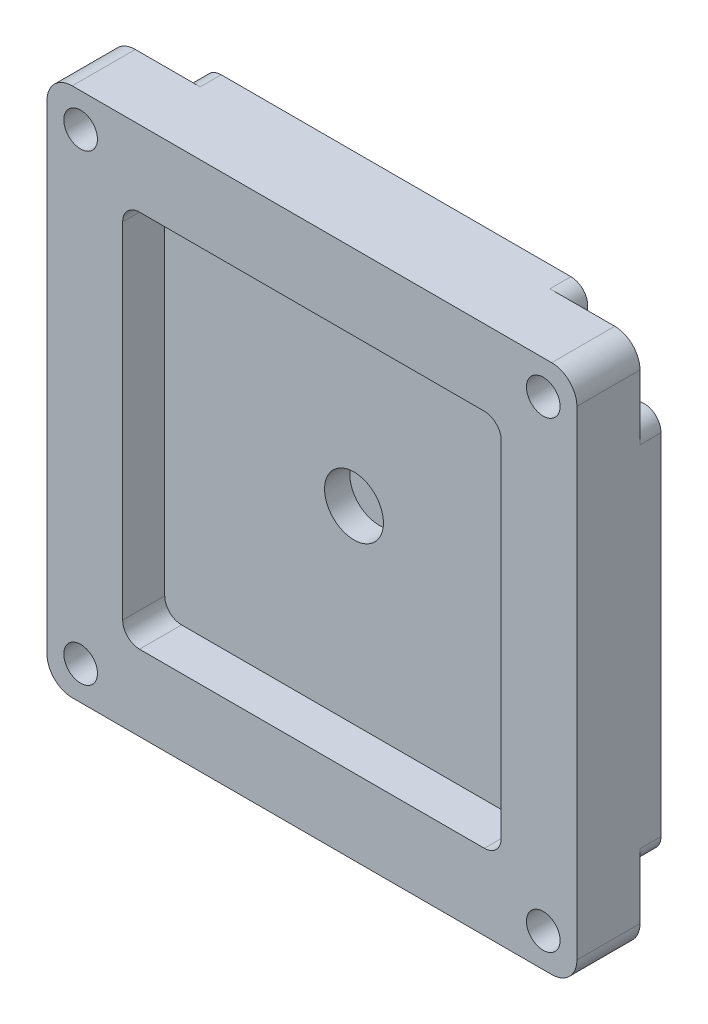
from build123d import *

# Parameters (mm, degrees)
SKETCH1_W                                  = 63
SKETCH1_H                                  = 63
SKETCH1_R                                  = 2
BOSS_EXTRUDE1_DEPTH                        = 5
SKETCH3_W                                  = 45
SKETCH3_H                                  = 45
CUT_EXTRUDE1_DEPTH                         = 5
FILLET1_R                                  = 3
SKETCH4_R                                  = 3.5
CUT_EXTRUDE2_DEPTH                         = 8
FILLET2_R                                  = 2
SKETCH5_R                                  = 5
CUT_EXTRUDE3_DEPTH                         = 2.5
MIRROR1_AT_THE_SECOND_PLANE_COPY_1_SKETC_R = 5
MIRROR1_AT_THE_SECOND_PLANE_COPY_1_DEPTH   = 2.5
FILLET3_R                                  = 2


with BuildPart() as part:
    # Sketch1 → Boss-Extrude1 (new, symmetric)
    with BuildSketch(Plane.XY):
        Rectangle(SKETCH1_W, SKETCH1_H)
        with Locations((-27.5, 27.5)):
            Circle(SKETCH1_R, mode=Mode.SUBTRACT)
        with Locations((27.5, 27.5)):
            Circle(SKETCH1_R, mode=Mode.SUBTRACT)
        with Locations((27.5, -27.5)):
            Circle(SKETCH1_R, mode=Mode.SUBTRACT)
        with Locations((-27.5, -27.5)):
            Circle(SKETCH1_R, mode=Mode.SUBTRACT)
    extrude(amount=BOSS_EXTRUDE1_DEPTH, both=True)

    # Sketch3 → Cut-Extrude1 (cut)
    with BuildSketch(Plane.XY.offset(5)):
        Rectangle(SKETCH3_W, SKETCH3_H)
    extrude(amount=-CUT_EXTRUDE1_DEPTH, mode=Mode.SUBTRACT)

    # Fillet1
    fillet1_edges = [part.edges().sort_by_distance(p)[0] for p in [
        (-31.5, 31.5, 0),
        (31.5, 31.5, 0),
        (31.5, -31.5, 0),
        (-31.5, -31.5, 0),
    ]]
    fillet(fillet1_edges, radius=FILLET1_R)

    # Sketch4 → Cut-Extrude2 (cut)
    with BuildSketch(Plane.XY.offset(5)):
        Circle(SKETCH4_R)
    extrude(amount=-CUT_EXTRUDE2_DEPTH, mode=Mode.SUBTRACT)

    # Fillet2
    fillet2_edges = [part.edges().sort_by_distance(p)[0] for p in [
        (-22.5, -22.5, 2.5),
        (-22.5, 22.5, 2.5),
        (22.5, 22.5, 2.5),
        (22.5, -22.5, 2.5),
    ]]
    fillet(fillet2_edges, radius=FILLET2_R)

    # Sketch5 → Cut-Extrude3 (cut)
    with BuildSketch(Plane(origin=(0, 0, -5), x_dir=(-1, 0, 0), z_dir=(0, 0, -1))):
        with Locations((-27.5, 27.5)):
            Circle(SKETCH5_R)
    cut_extrude3 = extrude(amount=-CUT_EXTRUDE3_DEPTH, mode=Mode.SUBTRACT)

    # Mirror1: Cut-Extrude3 across plane
    add(cut_extrude3.mirror(Plane(origin=(0, 0, 0), x_dir=(0, 0, 1), z_dir=(1, 0, 0))), mode=Mode.SUBTRACT)

    # Mirror1 at the second plane: Cut-Extrude3 across plane
    add(cut_extrude3.mirror(Plane.ZX), mode=Mode.SUBTRACT)

    # Mirror1 at the second plane copy 1 sketc → Mirror1 at the second plane copy 1 (cut)
    with BuildSketch(Plane(origin=(0, 0, -5), x_dir=(1, 0, 0), z_dir=(0, 0, -1))):
        with Locations((-27.5, 27.5)):
            Circle(MIRROR1_AT_THE_SECOND_PLANE_COPY_1_SKETC_R)
    extrude(amount=-MIRROR1_AT_THE_SECOND_PLANE_COPY_1_DEPTH, mode=Mode.SUBTRACT)

    # Fillet3
    fillet3_edges = [part.edges().sort_by_distance(p)[0] for p in [
        (24.5, 31.5, -3.75),
        (31.5, 24.5, -3.75),
        (31.5, -24.5, -3.75),
        (24.5, -31.5, -3.75),
        (-24.5, 31.5, -3.75),
        (-31.5, 24.5, -3.75),
        (-31.5, -24.5, -3.75),
        (-24.5, -31.5, -3.75),
    ]]
    fillet(fillet3_edges, radius=FILLET3_R)


solid = part.part
